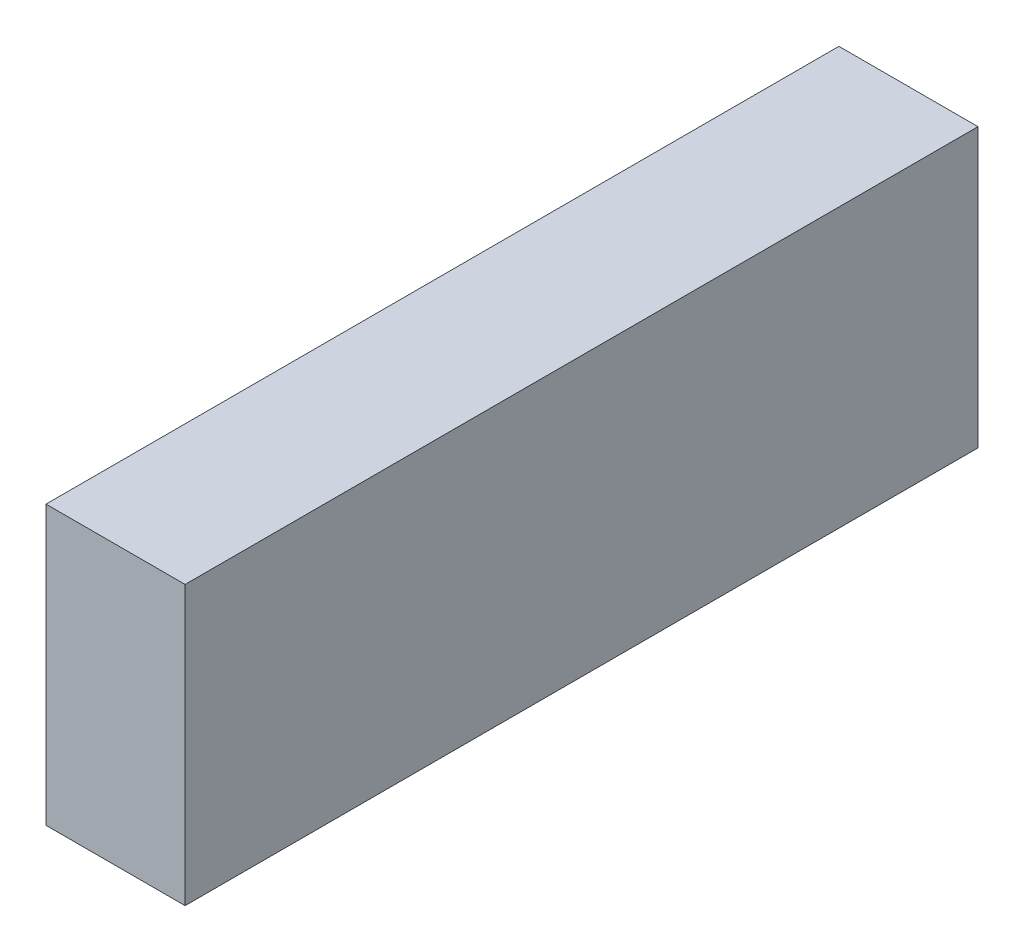
from build123d import *

# Parameters (mm, degrees)
SKETCH1_W           = 57
SKETCH1_H           = 20
BOSS_EXTRUDE1_DEPTH = 10


with BuildPart() as part:
    # Sketch1 → Boss-Extrude1 (new body)
    with BuildSketch(Plane(origin=(0, 0, 0), x_dir=(0, 0, -1), z_dir=(1, 0, 0))):
        with Locations((28.5, 10)):
            Rectangle(SKETCH1_W, SKETCH1_H)
    extrude(amount=BOSS_EXTRUDE1_DEPTH)


solid = part.part
